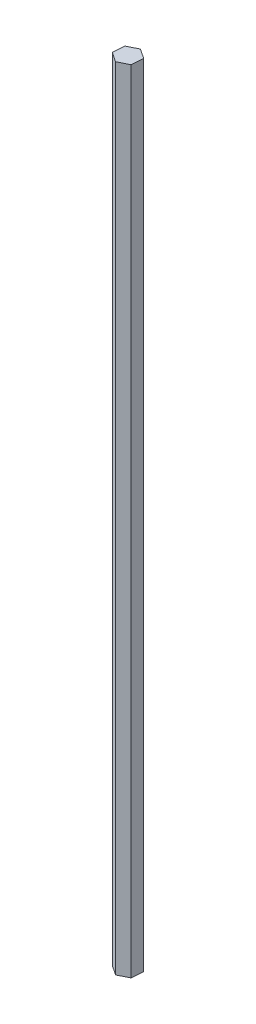
from build123d import *

# Parameters (mm, degrees)
BOSS_EXTRUDE1_DEPTH = 247.65


with BuildPart() as part:
    # Sketch1 → Boss-Extrude1 (new, symmetric)
    with BuildSketch(Plane(origin=(0, 0, 0), x_dir=(1, 0, 0), z_dir=(0, 1, 0))):
        Polygon((6.097750015, -4.071950157), (6.575287287, 3.244831341), (0.477537271, 7.316781498), (-6.097750015, 4.071950157), (-6.575287287, -3.244831341), (-0.477537271, -7.316781498), align=None)
    extrude(amount=BOSS_EXTRUDE1_DEPTH, both=True)


solid = part.part
